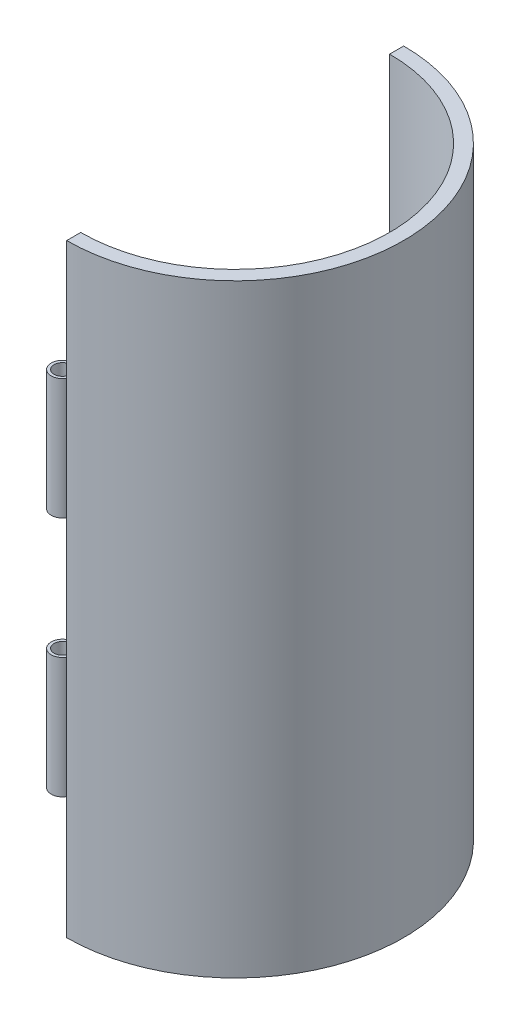
from build123d import *

# Parameters (mm, degrees)
BOSS_EXTRUDE1_DEPTH = 107.5
BOSS_EXTRUDE2_START = -21.5
SKETCH2_R           = 2
SKETCH2_R_2         = 1.5
BOSS_EXTRUDE2_DEPTH = 21.5
LPATTERN1_COUNT     = 2
LPATTERN1_PITCH     = 43


with BuildPart() as part:
    # Sketch1 → Boss-Extrude1 (new body)
    with BuildSketch(Plane(origin=(0, 0, 0), x_dir=(1, 0, 0), z_dir=(0, 1, 0))):
        with BuildLine():
            ThreePointArc((30, 0), (21.213203436, 21.213203436), (0, 30))
            Line((0, 30), (0, 27.5))
            ThreePointArc((0, 27.5), (19.445436483, 19.445436483), (27.5, 0))
            ThreePointArc((27.5, 0), (19.445436483, -19.445436483), (0, -27.5))
            Line((0, -27.5), (0, -30))
            ThreePointArc((0, -30), (21.213203436, -21.213203436), (30, 0))
        make_face()
    extrude(amount=BOSS_EXTRUDE1_DEPTH)


with BuildPart() as body_2:
    # Sketch2 → Boss-Extrude2 (new body)
    with BuildSketch(Plane.XZ.offset(BOSS_EXTRUDE2_START)):
        with Locations(Location((-2, 28.75, 0), (0, 0, 270))):
            Circle(SKETCH2_R)
        with Locations(Location((-2, 28.75, 0), (0, 0, 270))):
            Circle(SKETCH2_R_2, mode=Mode.SUBTRACT)
    boss_extrude2 = extrude(amount=-BOSS_EXTRUDE2_DEPTH)


with BuildPart() as lpattern1_1:
    # LPattern1: Boss-Extrude2 ×2
    with Locations(*[(0, i * LPATTERN1_PITCH, 0) for i in range(1, LPATTERN1_COUNT)]):
        add(boss_extrude2)


solid = Compound([part.part, body_2.part, lpattern1_1.part])
